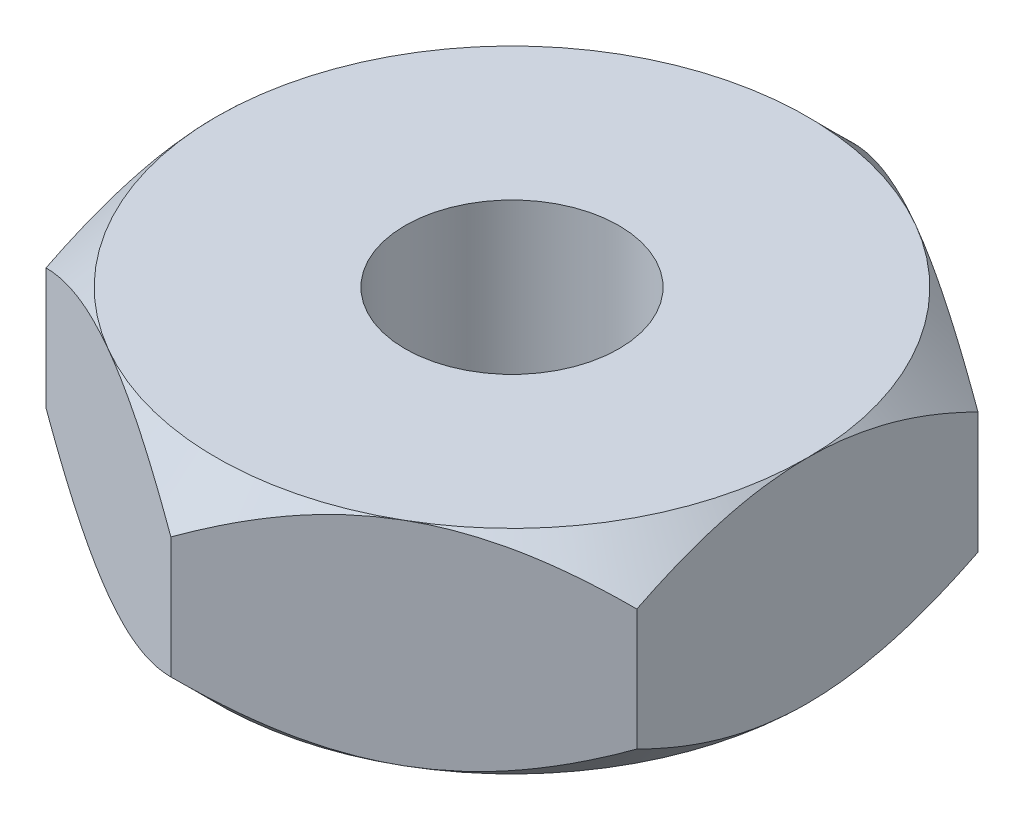
from build123d import *

# Parameters (mm, degrees)
BOSS_EXTRUDE1_DEPTH       = 1.125
F_4_40_TAPPED_HOLE1_D     = 2.2606
F_4_40_TAPPED_HOLE1_DEPTH = 8.87
F_4_40_TAPPED_HOLE1_TIP   = 0.679152758


with BuildPart() as part:
    # Sketch1 → Boss-Extrude1 (new, symmetric)
    with BuildSketch(Plane(origin=(0, 0, 0), x_dir=(1, 0, 0), z_dir=(0, 1, 0))):
        Polygon((0, 3.608439182), (-3.125, 1.804219591), (-3.125, -1.804219591), (0, -3.608439182), (3.125, -1.804219591), (3.125, 1.804219591), align=None)
    extrude(amount=BOSS_EXTRUDE1_DEPTH, both=True)

    # Sketch2 → Cut-Revolve2 (revolve, cut)
    with BuildSketch(Plane.XY):
        Polygon((-4.25, 1.125), (-4.25, 0), (-3.125, 1.125), align=None)
    cut_revolve2 = revolve(axis=Axis((0, 4.25, 0), (0, -1, 0)), mode=Mode.SUBTRACT)

    # Mirror1: Cut-Revolve2 across plane
    add(cut_revolve2.mirror(Plane.ZX), mode=Mode.SUBTRACT)

    # #4-40 Tapped Hole1
    with Locations(Plane(origin=(0, 1.125, 0), x_dir=(1, 0, 0), z_dir=(0, 1, 0))):
        with Locations((0, 0)):
            Hole(F_4_40_TAPPED_HOLE1_D / 2, depth=F_4_40_TAPPED_HOLE1_DEPTH)
            with Locations((0, 0, -(F_4_40_TAPPED_HOLE1_DEPTH + F_4_40_TAPPED_HOLE1_TIP / 2))):  # 118° drill point
                Cone(0, F_4_40_TAPPED_HOLE1_D / 2, F_4_40_TAPPED_HOLE1_TIP, mode=Mode.SUBTRACT)


solid = part.part
